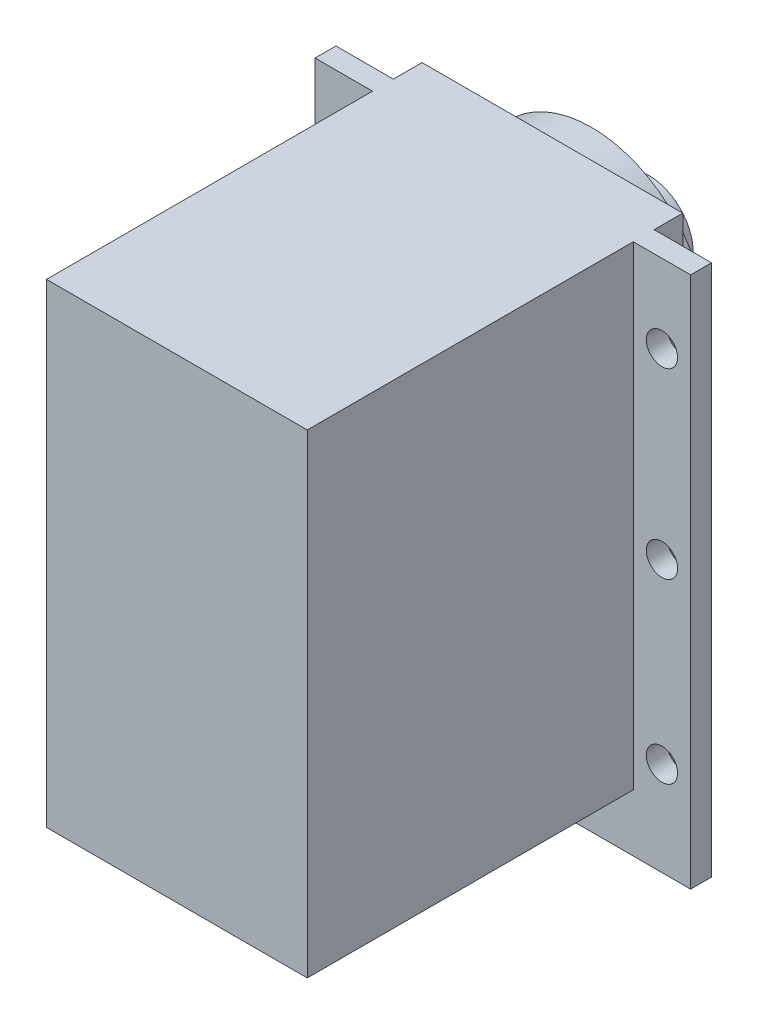
from build123d import *

# Parameters (mm, degrees)
SKETCH1_W           = 25
SKETCH1_H           = 45.5
BOSS_EXTRUDE1_DEPTH = 36
BOSS_EXTRUDE2_START = -2.75
SKETCH2_W           = 36
SKETCH2_H           = 51
SKETCH2_R           = 1.5
BOSS_EXTRUDE2_DEPTH = 2
SKETCH3_R           = 11
BOSS_EXTRUDE3_DEPTH = 3.75
SKETCH4_R           = 1.5
CUT_EXTRUDE1_DEPTH  = 3.75
SKETCH5_R           = 4.25
BOSS_EXTRUDE4_DEPTH = 5.5


with BuildPart() as part:
    # Sketch1 → Boss-Extrude1 (new body)
    with BuildSketch(Plane.XY):
        Rectangle(SKETCH1_W, SKETCH1_H)
    extrude(amount=BOSS_EXTRUDE1_DEPTH)

    # Sketch2 → Boss-Extrude2 (add)
    with BuildSketch(Plane(origin=(0, 0, 0), x_dir=(-1, 0, 0), z_dir=(0, 0, -1)).offset(BOSS_EXTRUDE2_START)):
        with Locations((0, -2.75)):
            Rectangle(SKETCH2_W, SKETCH2_H)
        with Locations((-15.25, 15.25)):
            Circle(SKETCH2_R, mode=Mode.SUBTRACT)
        with Locations((-15.25, -2.25)):
            Circle(SKETCH2_R, mode=Mode.SUBTRACT)
        with Locations((-15.25, -19.25)):
            Circle(SKETCH2_R, mode=Mode.SUBTRACT)
        with Locations((-7.5, -25.5)):
            Circle(SKETCH2_R, mode=Mode.SUBTRACT)
        with Locations((7.5, -25.5)):
            Circle(SKETCH2_R, mode=Mode.SUBTRACT)
        with Locations((15.25, -19.25)):
            Circle(SKETCH2_R, mode=Mode.SUBTRACT)
        with Locations((15.25, -2.25)):
            Circle(SKETCH2_R, mode=Mode.SUBTRACT)
        with Locations((15.25, 15.25)):
            Circle(SKETCH2_R, mode=Mode.SUBTRACT)
    extrude(amount=-BOSS_EXTRUDE2_DEPTH)

    # Sketch3 → Boss-Extrude3 (add)
    with BuildSketch(Plane(origin=(0, 0, 0), x_dir=(-1, 0, 0), z_dir=(0, 0, -1))):
        with Locations((0, 10.75)):
            Circle(SKETCH3_R)
    extrude(amount=BOSS_EXTRUDE3_DEPTH)

    # Sketch4 → Cut-Extrude1 (cut)
    with BuildSketch(Plane(origin=(0, 0, -3.75), x_dir=(-1, 0, 0), z_dir=(0, 0, -1))):
        with Locations((0, 18.75)):
            Circle(SKETCH4_R)
        with Locations((-5.656854249, 16.406854249)):
            Circle(SKETCH4_R)
        with Locations((-8, 10.75)):
            Circle(SKETCH4_R)
        with Locations((-5.656854249, 5.093145751)):
            Circle(SKETCH4_R)
        with Locations((0, 2.75)):
            Circle(SKETCH4_R)
        with Locations((5.656854249, 5.093145751)):
            Circle(SKETCH4_R)
        with Locations((8, 10.75)):
            Circle(SKETCH4_R)
        with Locations((5.656854249, 16.406854249)):
            Circle(SKETCH4_R)
    extrude(amount=-CUT_EXTRUDE1_DEPTH, mode=Mode.SUBTRACT)

    # Sketch5 → Boss-Extrude4 (add)
    with BuildSketch(Plane(origin=(0, 0, -3.75), x_dir=(-1, 0, 0), z_dir=(0, 0, -1))):
        with Locations((0, 10.75)):
            Circle(SKETCH5_R)
    extrude(amount=BOSS_EXTRUDE4_DEPTH)


solid = part.part
